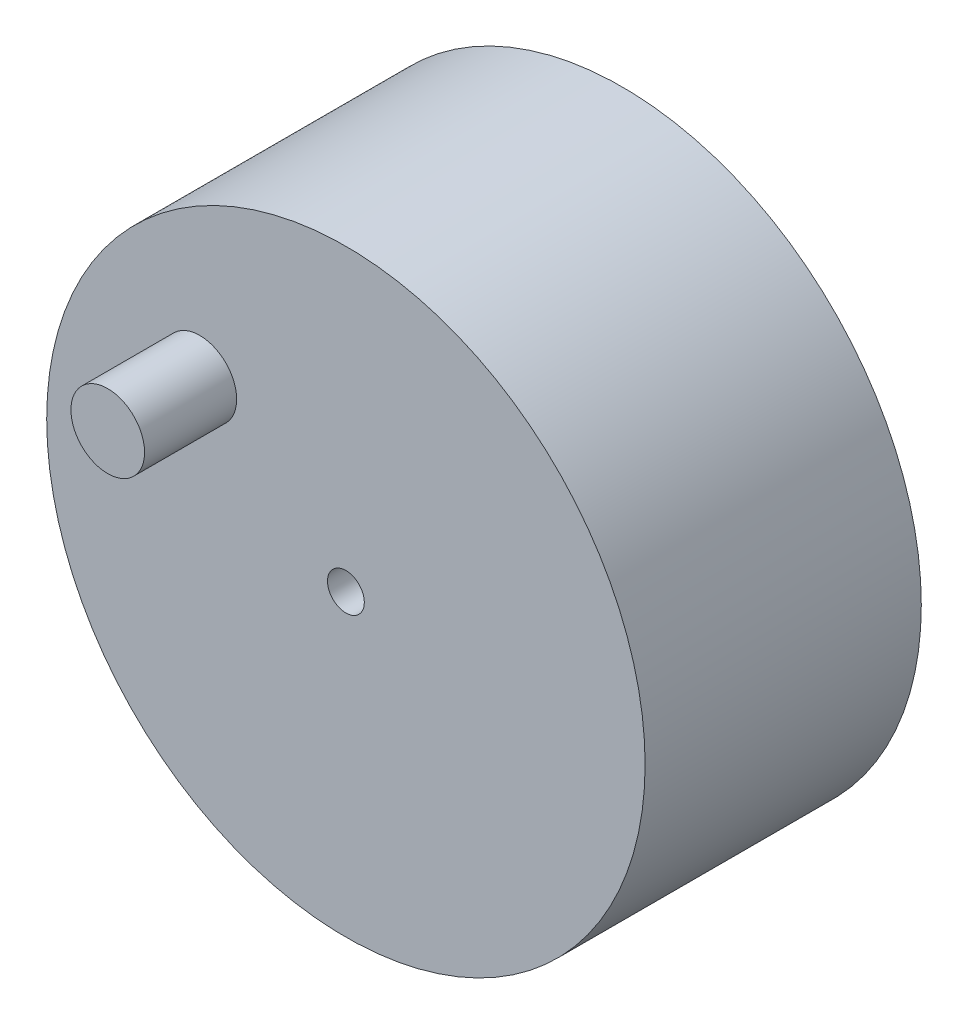
from build123d import *

# Parameters (mm, degrees)
ESQUISSE1_R        = 32.5
ESQUISSE1_R_2      = 2
BOSS_EXTRU_1_DEPTH = 30
ESQUISSE2_R        = 4
BOSS_EXTRU_2_DEPTH = 10


with BuildPart() as part:
    # Esquisse1 → Boss.-Extru.1 (new body)
    with BuildSketch(Plane.XY):
        Circle(ESQUISSE1_R)
        Circle(ESQUISSE1_R_2, mode=Mode.SUBTRACT)
    extrude(amount=BOSS_EXTRU_1_DEPTH)

    # Esquisse2 → Boss.-Extru.2 (add)
    with BuildSketch(Plane.XY.offset(30)):
        with Locations((-15.867490603, 12.174676257)):
            Circle(ESQUISSE2_R)
    extrude(amount=BOSS_EXTRU_2_DEPTH)


solid = part.part
